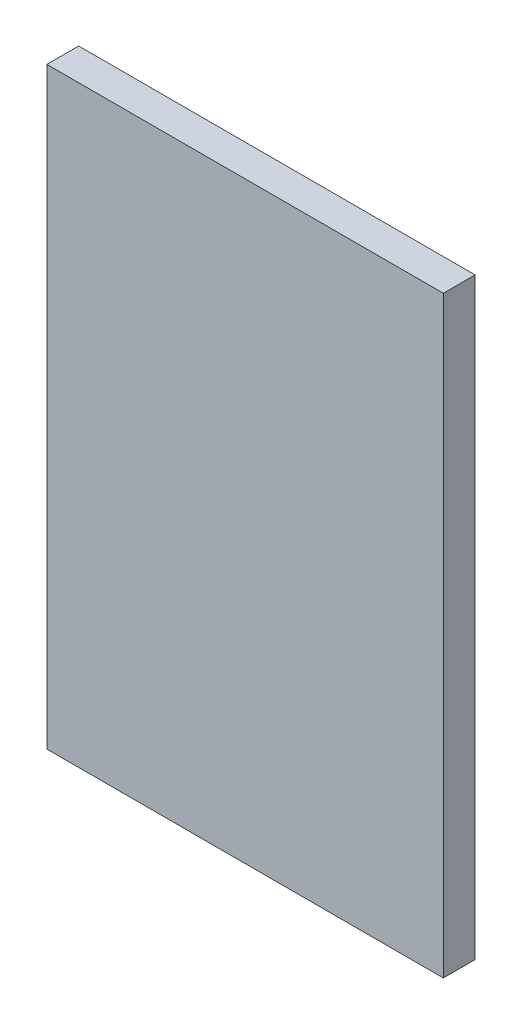
from build123d import *

# Parameters (mm, degrees)
SKETCH1_W           = 174.5
SKETCH1_H           = 261
BOSS_EXTRUDE1_DEPTH = 14


with BuildPart() as part:
    # Sketch1 → Boss-Extrude1 (new body)
    with BuildSketch(Plane.XY):
        Rectangle(SKETCH1_W, SKETCH1_H)
    extrude(amount=BOSS_EXTRUDE1_DEPTH)


solid = part.part
